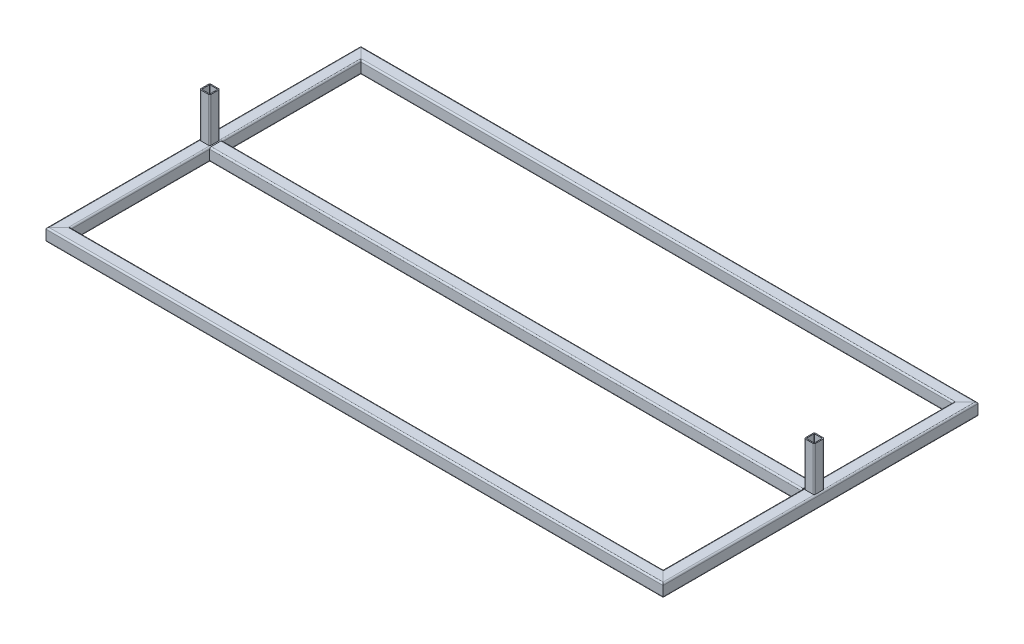
from build123d import *

# Parameters (mm, degrees)
SQUARE_TUBE_CONFIGURED_20_X_20_X_2_1_DEPTH      = 1218.67766953
SQUARE_TUBE_CONFIGURED_20_X_20_X_2_1_DEPTH_BACK = 18.67766953
SQUARE_TUBE_CONFIGURED_20_X_20_X_2_1_2_DEPTH    = 637.355339059
SQUARE_TUBE_CONFIGURED_20_X_20_X_2_1_3_DEPTH    = 1237.355339059
SQUARE_TUBE_CONFIGURED_20_X_20_X_2_1_4_DEPTH    = 637.355339059
SQUARE_TUBE_CONFIGURED_20_X_20_X_2_1_5_DEPTH    = 1202
SQUARE_TUBE_CONFIGURED_20_X_20_X_2_11_DEPTH     = 100
SQUARE_TUBE_CONFIGURED_20_X_20_X_2_12_DEPTH     = 100
SKETCH_3_R                                      = 6
CUT_EXTRUDE_2_DEPTH                             = 5
MIRROR_2_COPY_1_SKETCH_R                        = 6
MIRROR_2_COPY_1_DEPTH                           = 5


with BuildPart() as part:
    # Sketch11 → Square tube - configured 20 X 20 X 2(1) (new, two sides: drawn at the far end of the back side and taken through both)
    with BuildSketch(Plane(origin=(-600, 0, -300), x_dir=(0, 0, -1), z_dir=(1, 0, 0)).offset(-SQUARE_TUBE_CONFIGURED_20_X_20_X_2_1_DEPTH_BACK)):
        with BuildLine():
            Line((-9.5, -12.5), (9.5, -12.5))
            ThreePointArc((9.5, -12.5), (11.621320344, -11.621320344), (12.5, -9.5))
            Line((12.5, -9.5), (12.5, 9.5))
            ThreePointArc((12.5, 9.5), (11.621320344, 11.621320344), (9.5, 12.5))
            Line((9.5, 12.5), (-9.5, 12.5))
            ThreePointArc((-9.5, 12.5), (-11.621320344, 11.621320344), (-12.5, 9.5))
            Line((-12.5, 9.5), (-12.5, -9.5))
            ThreePointArc((-12.5, -9.5), (-11.621320344, -11.621320344), (-9.5, -12.5))
        make_face()
        with BuildLine():
            Line((-9.5, -10.5), (9.5, -10.5))
            ThreePointArc((9.5, -10.5), (10.207106781, -10.207106781), (10.5, -9.5))
            Line((10.5, -9.5), (10.5, 9.5))
            ThreePointArc((10.5, 9.5), (10.207106781, 10.207106781), (9.5, 10.5))
            Line((9.5, 10.5), (-9.5, 10.5))
            ThreePointArc((-9.5, 10.5), (-10.207106781, 10.207106781), (-10.5, 9.5))
            Line((-10.5, 9.5), (-10.5, -9.5))
            ThreePointArc((-10.5, -9.5), (-10.207106781, -10.207106781), (-9.5, -10.5))
        make_face(mode=Mode.SUBTRACT)
    extrude(amount=SQUARE_TUBE_CONFIGURED_20_X_20_X_2_1_DEPTH + SQUARE_TUBE_CONFIGURED_20_X_20_X_2_1_DEPTH_BACK)

    # Square tube - configured 20 X 20 X 2(1) m
    split(bisect_by=Plane(origin=(-600, 0, -300), x_dir=(0, 1, 0), z_dir=(0.707106781, 0, -0.707106781)), keep=Keep.TOP)

    # Square tube - configured 20 X 20 X 2 2
    split(bisect_by=Plane(origin=(600, 0, -300), x_dir=(0, -1, 0), z_dir=(-0.707106781, 0, -0.707106781)), keep=Keep.TOP)


with BuildPart() as body_2:
    # Sketch11 on segment 2 (carried to segment 2) → Square tube - configured 20 X 20 X 2_1 2 (new body)
    with BuildSketch(Plane(origin=(600, 0, -318.67766953), x_dir=(1, 0, 0), z_dir=(0, 0, 1))):
        with BuildLine():
            Line((-9.5, -12.5), (9.5, -12.5))
            ThreePointArc((9.5, -12.5), (11.621320344, -11.621320344), (12.5, -9.5))
            Line((12.5, -9.5), (12.5, 9.5))
            ThreePointArc((12.5, 9.5), (11.621320344, 11.621320344), (9.5, 12.5))
            Line((9.5, 12.5), (-9.5, 12.5))
            ThreePointArc((-9.5, 12.5), (-11.621320344, 11.621320344), (-12.5, 9.5))
            Line((-12.5, 9.5), (-12.5, -9.5))
            ThreePointArc((-12.5, -9.5), (-11.621320344, -11.621320344), (-9.5, -12.5))
        make_face()
        with BuildLine():
            Line((-9.5, -10.5), (9.5, -10.5))
            ThreePointArc((9.5, -10.5), (10.207106781, -10.207106781), (10.5, -9.5))
            Line((10.5, -9.5), (10.5, 9.5))
            ThreePointArc((10.5, 9.5), (10.207106781, 10.207106781), (9.5, 10.5))
            Line((9.5, 10.5), (-9.5, 10.5))
            ThreePointArc((-9.5, 10.5), (-10.207106781, 10.207106781), (-10.5, 9.5))
            Line((-10.5, 9.5), (-10.5, -9.5))
            ThreePointArc((-10.5, -9.5), (-10.207106781, -10.207106781), (-9.5, -10.5))
        make_face(mode=Mode.SUBTRACT)
    extrude(amount=SQUARE_TUBE_CONFIGURED_20_X_20_X_2_1_2_DEPTH)

    # Square tube - configured 20 X 20 X 2 3
    split(bisect_by=Plane(origin=(600, 0, 300), x_dir=(0, 1, 0), z_dir=(0.707106781, 0, -0.707106781)), keep=Keep.TOP)

    # Square tube - configured 20 X 20 X 2 4
    split(bisect_by=Plane(origin=(600, 0, -300), x_dir=(0, 1, 0), z_dir=(0.707106781, 0, 0.707106781)), keep=Keep.TOP)


with BuildPart() as body_3:
    # Sketch11 on segment 3 (carried to segment 3) → Square tube - configured 20 X 20 X 2_1 3 (new body)
    with BuildSketch(Plane(origin=(618.67766953, 0, 300), x_dir=(0, 0, 1), z_dir=(-1, 0, 0))):
        with BuildLine():
            Line((-9.5, -12.5), (9.5, -12.5))
            ThreePointArc((9.5, -12.5), (11.621320344, -11.621320344), (12.5, -9.5))
            Line((12.5, -9.5), (12.5, 9.5))
            ThreePointArc((12.5, 9.5), (11.621320344, 11.621320344), (9.5, 12.5))
            Line((9.5, 12.5), (-9.5, 12.5))
            ThreePointArc((-9.5, 12.5), (-11.621320344, 11.621320344), (-12.5, 9.5))
            Line((-12.5, 9.5), (-12.5, -9.5))
            ThreePointArc((-12.5, -9.5), (-11.621320344, -11.621320344), (-9.5, -12.5))
        make_face()
        with BuildLine():
            Line((-9.5, -10.5), (9.5, -10.5))
            ThreePointArc((9.5, -10.5), (10.207106781, -10.207106781), (10.5, -9.5))
            Line((10.5, -9.5), (10.5, 9.5))
            ThreePointArc((10.5, 9.5), (10.207106781, 10.207106781), (9.5, 10.5))
            Line((9.5, 10.5), (-9.5, 10.5))
            ThreePointArc((-9.5, 10.5), (-10.207106781, 10.207106781), (-10.5, 9.5))
            Line((-10.5, 9.5), (-10.5, -9.5))
            ThreePointArc((-10.5, -9.5), (-10.207106781, -10.207106781), (-9.5, -10.5))
        make_face(mode=Mode.SUBTRACT)
    extrude(amount=SQUARE_TUBE_CONFIGURED_20_X_20_X_2_1_3_DEPTH)

    # Square tube - configured 20 X 20 X 2 5
    split(bisect_by=Plane(origin=(-600, 0, 300), x_dir=(0, 1, 0), z_dir=(0.707106781, 0, 0.707106781)), keep=Keep.TOP)

    # Square tube - configured 20 X 20 X 2 6
    split(bisect_by=Plane(origin=(600, 0, 300), x_dir=(0, -1, 0), z_dir=(-0.707106781, 0, 0.707106781)), keep=Keep.TOP)


with BuildPart() as body_4:
    # Sketch11 on segment 4 (carried to segment 4) → Square tube - configured 20 X 20 X 2_1 4 (new body)
    with BuildSketch(Plane(origin=(-600, 0, 318.67766953), x_dir=(-1, 0, 0), z_dir=(0, 0, -1))):
        with BuildLine():
            Line((-9.5, -12.5), (9.5, -12.5))
            ThreePointArc((9.5, -12.5), (11.621320344, -11.621320344), (12.5, -9.5))
            Line((12.5, -9.5), (12.5, 9.5))
            ThreePointArc((12.5, 9.5), (11.621320344, 11.621320344), (9.5, 12.5))
            Line((9.5, 12.5), (-9.5, 12.5))
            ThreePointArc((-9.5, 12.5), (-11.621320344, 11.621320344), (-12.5, 9.5))
            Line((-12.5, 9.5), (-12.5, -9.5))
            ThreePointArc((-12.5, -9.5), (-11.621320344, -11.621320344), (-9.5, -12.5))
        make_face()
        with BuildLine():
            Line((-9.5, -10.5), (9.5, -10.5))
            ThreePointArc((9.5, -10.5), (10.207106781, -10.207106781), (10.5, -9.5))
            Line((10.5, -9.5), (10.5, 9.5))
            ThreePointArc((10.5, 9.5), (10.207106781, 10.207106781), (9.5, 10.5))
            Line((9.5, 10.5), (-9.5, 10.5))
            ThreePointArc((-9.5, 10.5), (-10.207106781, 10.207106781), (-10.5, 9.5))
            Line((-10.5, 9.5), (-10.5, -9.5))
            ThreePointArc((-10.5, -9.5), (-10.207106781, -10.207106781), (-9.5, -10.5))
        make_face(mode=Mode.SUBTRACT)
    extrude(amount=SQUARE_TUBE_CONFIGURED_20_X_20_X_2_1_4_DEPTH)

    # Square tube - configured 20 X 20 X 2 7
    split(bisect_by=Plane(origin=(-600, 0, 300), x_dir=(0, -1, 0), z_dir=(-0.707106781, 0, -0.707106781)), keep=Keep.TOP)

    # Square tube - configured 20 X 20 X 2 8
    split(bisect_by=Plane(origin=(-600, 0, -300), x_dir=(0, -1, 0), z_dir=(-0.707106781, 0, 0.707106781)), keep=Keep.TOP)


with BuildPart() as body_5:
    # Sketch11 on segment 5 (carried to segment 5) → Square tube - configured 20 X 20 X 2_1 5 (new body)
    with BuildSketch(Plane(origin=(-601, 0, 0), x_dir=(0, 0, -1), z_dir=(1, 0, 0))):
        with BuildLine():
            Line((-9.5, -12.5), (9.5, -12.5))
            ThreePointArc((9.5, -12.5), (11.621320344, -11.621320344), (12.5, -9.5))
            Line((12.5, -9.5), (12.5, 9.5))
            ThreePointArc((12.5, 9.5), (11.621320344, 11.621320344), (9.5, 12.5))
            Line((9.5, 12.5), (-9.5, 12.5))
            ThreePointArc((-9.5, 12.5), (-11.621320344, 11.621320344), (-12.5, 9.5))
            Line((-12.5, 9.5), (-12.5, -9.5))
            ThreePointArc((-12.5, -9.5), (-11.621320344, -11.621320344), (-9.5, -12.5))
        make_face()
        with BuildLine():
            Line((-9.5, -10.5), (9.5, -10.5))
            ThreePointArc((9.5, -10.5), (10.207106781, -10.207106781), (10.5, -9.5))
            Line((10.5, -9.5), (10.5, 9.5))
            ThreePointArc((10.5, 9.5), (10.207106781, 10.207106781), (9.5, 10.5))
            Line((9.5, 10.5), (-9.5, 10.5))
            ThreePointArc((-9.5, 10.5), (-10.207106781, 10.207106781), (-10.5, 9.5))
            Line((-10.5, 9.5), (-10.5, -9.5))
            ThreePointArc((-10.5, -9.5), (-10.207106781, -10.207106781), (-9.5, -10.5))
        make_face(mode=Mode.SUBTRACT)
    extrude(amount=SQUARE_TUBE_CONFIGURED_20_X_20_X_2_1_5_DEPTH)

    # Square tube - configured 20 X 20 X 2 9
    split(bisect_by=Plane.YZ.offset(-587.5), keep=Keep.TOP)

    # Square tube - configured 20 X 20 X 2 10
    split(bisect_by=Plane(origin=(587.5, 0, 0), x_dir=(0, -1, 0), z_dir=(-1, 0, 0)), keep=Keep.TOP)


with BuildPart() as body_6:
    # Sketch1 → Square tube - configured 20 X 20 X 2 11 (new body)
    with BuildSketch(Plane(origin=(-600, 0, 0), x_dir=(1, 0, 0), z_dir=(0, 1, 0))):
        with BuildLine():
            Line((-7.5, -10), (7.5, -10))
            ThreePointArc((7.5, -10), (9.267766953, -9.267766953), (10, -7.5))
            Line((10, -7.5), (10, 7.5))
            ThreePointArc((10, 7.5), (9.267766953, 9.267766953), (7.5, 10))
            Line((7.5, 10), (-7.5, 10))
            ThreePointArc((-7.5, 10), (-9.267766953, 9.267766953), (-10, 7.5))
            Line((-10, 7.5), (-10, -7.5))
            ThreePointArc((-10, -7.5), (-9.267766953, -9.267766953), (-7.5, -10))
        make_face()
        with BuildLine():
            Line((-7.5, -8), (7.5, -8))
            ThreePointArc((7.5, -8), (7.853553391, -7.853553391), (8, -7.5))
            Line((8, -7.5), (8, 7.5))
            ThreePointArc((8, 7.5), (7.853553391, 7.853553391), (7.5, 8))
            Line((7.5, 8), (-7.5, 8))
            ThreePointArc((-7.5, 8), (-7.853553391, 7.853553391), (-8, 7.5))
            Line((-8, 7.5), (-8, -7.5))
            ThreePointArc((-8, -7.5), (-7.853553391, -7.853553391), (-7.5, -8))
        make_face(mode=Mode.SUBTRACT)
    extrude(amount=SQUARE_TUBE_CONFIGURED_20_X_20_X_2_11_DEPTH)

    # Weld Trim 1
    split(bisect_by=Plane(origin=(600.100277778, 12.5, 0), x_dir=(-1, 0, 0), z_dir=(0, 1, 0)), keep=Keep.TOP)


with BuildPart() as body_7:
    # Sketch1 on segment 2 (carried to segment 2) → Square tube - configured 20 X 20 X 2 12 (new body)
    with BuildSketch(Plane(origin=(600, 0, 0), x_dir=(1, 0, 0), z_dir=(0, 1, 0))):
        with BuildLine():
            Line((-7.5, -10), (7.5, -10))
            ThreePointArc((7.5, -10), (9.267766953, -9.267766953), (10, -7.5))
            Line((10, -7.5), (10, 7.5))
            ThreePointArc((10, 7.5), (9.267766953, 9.267766953), (7.5, 10))
            Line((7.5, 10), (-7.5, 10))
            ThreePointArc((-7.5, 10), (-9.267766953, 9.267766953), (-10, 7.5))
            Line((-10, 7.5), (-10, -7.5))
            ThreePointArc((-10, -7.5), (-9.267766953, -9.267766953), (-7.5, -10))
        make_face()
        with BuildLine():
            Line((-7.5, -8), (7.5, -8))
            ThreePointArc((7.5, -8), (7.853553391, -7.853553391), (8, -7.5))
            Line((8, -7.5), (8, 7.5))
            ThreePointArc((8, 7.5), (7.853553391, 7.853553391), (7.5, 8))
            Line((7.5, 8), (-7.5, 8))
            ThreePointArc((-7.5, 8), (-7.853553391, 7.853553391), (-8, 7.5))
            Line((-8, 7.5), (-8, -7.5))
            ThreePointArc((-8, -7.5), (-7.853553391, -7.853553391), (-7.5, -8))
        make_face(mode=Mode.SUBTRACT)
    extrude(amount=SQUARE_TUBE_CONFIGURED_20_X_20_X_2_12_DEPTH)

    # Weld Trim 1
    split(bisect_by=Plane(origin=(600.100277778, 12.5, 0), x_dir=(-1, 0, 0), z_dir=(0, 1, 0)), keep=Keep.TOP)


with BuildPart() as cut_extrude_2_tool:
    # Эскиз3 → Вырез-Вытянуть2 (new body)
    with BuildSketch(Plane(origin=(0, -12.5, 0), x_dir=(-1, 0, 0), z_dir=(0, -1, 0))):
        with Locations((600, -300)):
            Circle(SKETCH_3_R)
    cut_extrude_2 = extrude(amount=-CUT_EXTRUDE_2_DEPTH)


with BuildPart() as body_3_1:
    add(body_3.part)

    # Вырез-Вытянуть2: cut by cut_extrude_2_tool
    add(cut_extrude_2_tool.part, mode=Mode.SUBTRACT)


with BuildPart() as body_4_1:
    add(body_4.part)

    # Вырез-Вытянуть2: cut by cut_extrude_2_tool
    add(cut_extrude_2_tool.part, mode=Mode.SUBTRACT)


with BuildPart() as mirror_1_tool:
    # Зеркальное отражение1: Вырез-Вытянуть2 across plane
    add(cut_extrude_2.mirror(Plane(origin=(0, 0, 0), x_dir=(0, 0, 1), z_dir=(1, 0, 0))))


with BuildPart() as body_2_1:
    add(body_2.part)

    # Зеркальное отражение1: cut by mirror_1_tool
    add(mirror_1_tool.part, mode=Mode.SUBTRACT)


with BuildPart() as body_3_2:
    add(body_3_1.part)

    # Зеркальное отражение1: cut by mirror_1_tool
    add(mirror_1_tool.part, mode=Mode.SUBTRACT)


with BuildPart() as mirror_2_tool:
    # Зеркальное отражение2: Вырез-Вытянуть2 across plane
    add(cut_extrude_2.mirror(Plane.XY))


with BuildPart() as part_1:
    add(part.part)

    # Зеркальное отражение2: cut by mirror_2_tool
    add(mirror_2_tool.part, mode=Mode.SUBTRACT)


with BuildPart() as body_4_2:
    add(body_4_1.part)

    # Зеркальное отражение2: cut by mirror_2_tool
    add(mirror_2_tool.part, mode=Mode.SUBTRACT)


with BuildPart() as mirror_2_copy_1_tool:
    # Зеркальное отражение2 copy 1 sketch → Зеркальное отражение2 copy 1 (new body)
    with BuildSketch(Plane.XZ.offset(12.5)):
        with Locations((600, -300)):
            Circle(MIRROR_2_COPY_1_SKETCH_R)
    extrude(amount=-MIRROR_2_COPY_1_DEPTH)


with BuildPart() as part_2:
    add(part_1.part)

    # Зеркальное отражение2 copy 1: cut by mirror_2_copy_1_tool
    add(mirror_2_copy_1_tool.part, mode=Mode.SUBTRACT)


with BuildPart() as body_2_2:
    add(body_2_1.part)

    # Зеркальное отражение2 copy 1: cut by mirror_2_copy_1_tool
    add(mirror_2_copy_1_tool.part, mode=Mode.SUBTRACT)


solid = Compound([body_5.part, body_6.part, body_7.part, body_3_2.part, body_4_2.part, part_2.part, body_2_2.part])
